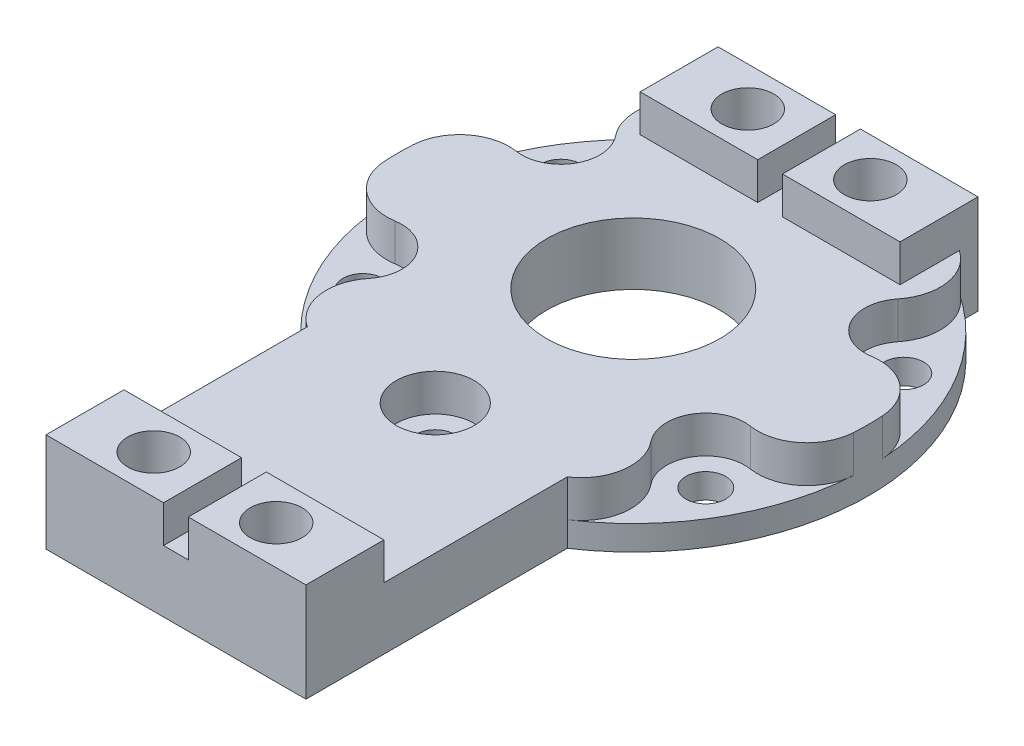
from build123d import *

# Parameters (mm, degrees)
SKETCH1_R           = 1.6
SKETCH1_R_2         = 2.1
SKETCH1_R_3         = 7
BOSS_EXTRUDE1_DEPTH = 5
SKETCH2_R           = 3.15
CUT_EXTRUDE1_DEPTH  = 3
SKETCH3_W           = 9.5
SKETCH3_H           = 6.3
SKETCH3_R           = 2.1
BOSS_EXTRUDE2_DEPTH = 3
FILLET2_R           = 4


with BuildPart() as part:
    # Sketch1 → Boss-Extrude1 (new body)
    with BuildSketch(Plane(origin=(0, 0, 0), x_dir=(1, 0, 0), z_dir=(0, 1, 0))):
        with BuildLine():
            Line((10.5, -36.95), (-10.5, -36.95))
            Line((-10.5, -36.95), (-10.5, -15.835087622))
            ThreePointArc((-10.5, -15.835087622), (-19, 0), (-10.5, 15.835087622))
            Line((-10.5, 15.835087622), (-10.5, 17.35))
            Line((-10.5, 17.35), (10.5, 17.35))
            Line((10.5, 17.35), (10.5, 15.835087622))
            ThreePointArc((10.5, 15.835087622), (19, 0), (10.5, -15.835087622))
            Line((10.5, -15.835087622), (10.5, -36.95))
        make_face()
        with Locations(Location((13.856406461, 8, 0), (0, 0, 270))):
            Circle(SKETCH1_R, mode=Mode.SUBTRACT)
        with Locations(Location((13.856406461, -8, 0), (0, 0, 270))):
            Circle(SKETCH1_R, mode=Mode.SUBTRACT)
        with Locations(Location((0, -16, 0), (0, 0, 270))):
            Circle(SKETCH1_R, mode=Mode.SUBTRACT)
        with Locations(Location((-13.856406461, -8, 0), (0, 0, 270))):
            Circle(SKETCH1_R, mode=Mode.SUBTRACT)
        with Locations(Location((-13.856406461, 8, 0), (0, 0, 270))):
            Circle(SKETCH1_R, mode=Mode.SUBTRACT)
        with Locations(Location((-4.95, 14.2, 0), (0, 0, 270))):
            Circle(SKETCH1_R_2, mode=Mode.SUBTRACT)
        with Locations(Location((4.95, 14.2, 0), (0, 0, 90))):
            Circle(SKETCH1_R_2, mode=Mode.SUBTRACT)
        with Locations(Location((4.95, -33.8, 0), (0, 0, 270))):
            Circle(SKETCH1_R_2, mode=Mode.SUBTRACT)
        with Locations(Location((-4.95, -33.8, 0), (0, 0, 90))):
            Circle(SKETCH1_R_2, mode=Mode.SUBTRACT)
        with Locations(Location((0, 0, 0), (0, 0, 270))):
            Circle(SKETCH1_R_3, mode=Mode.SUBTRACT)
    extrude(amount=BOSS_EXTRUDE1_DEPTH)

    # Sketch2 → Cut-Extrude1 (cut)
    with BuildSketch(Plane(origin=(0, 5, 0), x_dir=(1, 0, 0), z_dir=(0, 1, 0))):
        with Locations((-13.856406461, 8)):
            Circle(SKETCH2_R)
        with Locations((13.856406461, 8)):
            Circle(SKETCH2_R)
        with Locations((13.856406461, -8)):
            Circle(SKETCH2_R)
        with Locations(Location((0, -16, 0), (0, 0, 270))):
            Circle(SKETCH2_R)
        with Locations((-13.856406461, -8)):
            Circle(SKETCH2_R)
    extrude(amount=-CUT_EXTRUDE1_DEPTH, mode=Mode.SUBTRACT)

    # Sketch3 → Boss-Extrude2 (add)
    # profile 1 of 4: a face of its own
    with BuildSketch(Plane(origin=(0, 5, 0), x_dir=(1, 0, 0), z_dir=(0, 1, 0))):
        with Locations((-5.75, 14.2)):
            Rectangle(SKETCH3_W, SKETCH3_H)
        with Locations(Location((-4.95, 14.2, 0), (0, 0, 270))):
            Circle(SKETCH3_R, mode=Mode.SUBTRACT)
    # profile 2 of 4: a face of its own
    with BuildSketch(Plane(origin=(0, 5, 0), x_dir=(1, 0, 0), z_dir=(0, 1, 0))):
        with Locations((5.75, 14.2)):
            Rectangle(SKETCH3_W, SKETCH3_H)
        with Locations(Location((4.95, 14.2, 0), (0, 0, 90))):
            Circle(SKETCH3_R, mode=Mode.SUBTRACT)
    # profile 3 of 4: a face of its own
    with BuildSketch(Plane(origin=(0, 5, 0), x_dir=(1, 0, 0), z_dir=(0, 1, 0))):
        with Locations((5.75, -33.8)):
            Rectangle(SKETCH3_W, SKETCH3_H)
        with Locations(Location((4.95, -33.8, 0), (0, 0, 270))):
            Circle(SKETCH3_R, mode=Mode.SUBTRACT)
    # profile 4 of 4: a face of its own
    with BuildSketch(Plane(origin=(0, 5, 0), x_dir=(1, 0, 0), z_dir=(0, 1, 0))):
        with Locations((-5.75, -33.8)):
            Rectangle(SKETCH3_W, SKETCH3_H)
        with Locations(Location((-4.95, -33.8, 0), (0, 0, 90))):
            Circle(SKETCH3_R, mode=Mode.SUBTRACT)
    extrude(amount=BOSS_EXTRUDE2_DEPTH)

    # Fillet2
    fillet2_edges = [part.edges().sort_by_distance(p)[0] for p in [
        (-16.952641455, 3.5, -8.579507427),
        (-15.906392111, 3.5, -10.391664448),
        (-15.906392111, 3.5, 10.391664448),
        (-16.952641455, 3.5, 8.579507427),
        (15.906392111, 3.5, -10.391664448),
        (16.952641455, 3.5, -8.579507427),
        (16.952641455, 3.5, 8.579507427),
        (15.906392111, 3.5, 10.391664448),
    ]]
    fillet(fillet2_edges, radius=FILLET2_R)


solid = part.part
